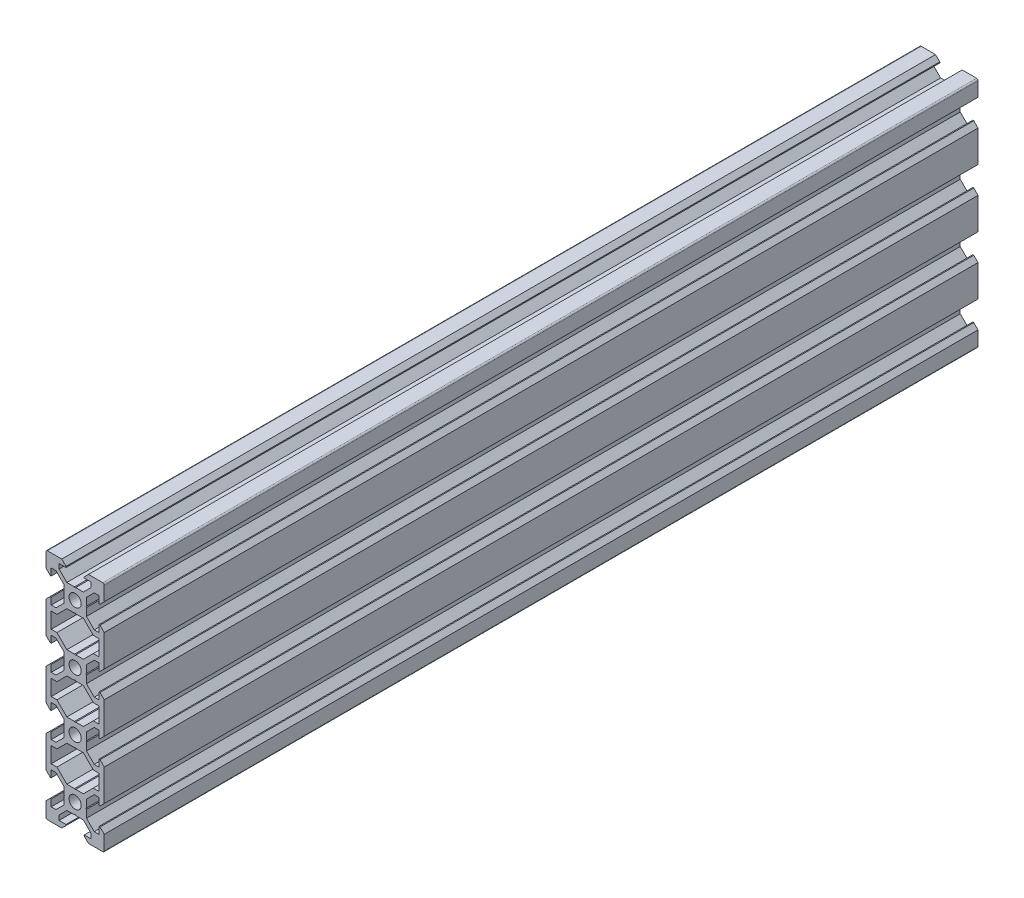
from build123d import *

# Parameters (mm, degrees)
BOSS_EXTRU_1_DEPTH = 300


with BuildPart() as part:
    # Esquisse1 → Boss.-Extru.1 (new body)
    with BuildSketch(Plane.XY):
        with BuildLine():
            Line((-9.5, 10), (-4.58, 10))
            Line((-4.58, 10), (-3.125, 8.545))
            Line((-3.125, 8.545), (-3.125, 8.2))
            Line((-3.125, 8.2), (-5.5, 8.2))
            Line((-5.5, 8.2), (-5.5, 6.560660172))
            Line((-5.5, 6.560660172), (-2.839339828, 3.9))
            Line((-2.839339828, 3.9), (-0.21, 3.9))
            Line((-0.21, 3.9), (0, 3.69))
            Line((0, 3.69), (0, 2.1))
            ThreePointArc((0, 2.1), (-2.1, 0), (0, -2.1))
            Line((0, -2.1), (0, -3.69))
            Line((0, -3.69), (-0.21, -3.9))
            Line((-0.21, -3.9), (-2.839339828, -3.9))
            Line((-2.839339828, -3.9), (-6.239339828, -7.3))
            Line((-6.239339828, -7.3), (-8.2, -7.3))
            Line((-8.2, -7.3), (-8.2, -12.7))
            Line((-8.2, -12.7), (-6.239339828, -12.7))
            Line((-6.239339828, -12.7), (-2.839339828, -16.1))
            Line((-2.839339828, -16.1), (-0.21, -16.1))
            Line((-0.21, -16.1), (0, -16.31))
            Line((0, -16.31), (0, -17.9))
            ThreePointArc((0, -17.9), (-2.1, -20), (0, -22.1))
            Line((0, -22.1), (0, -23.69))
            Line((0, -23.69), (-0.21, -23.9))
            Line((-0.21, -23.9), (-2.839339828, -23.9))
            Line((-2.839339828, -23.9), (-6.239339828, -27.3))
            Line((-6.239339828, -27.3), (-8.2, -27.3))
            Line((-8.2, -27.3), (-8.2, -32.7))
            Line((-8.2, -32.7), (-6.239339828, -32.7))
            Line((-6.239339828, -32.7), (-2.839339828, -36.1))
            Line((-2.839339828, -36.1), (-0.21, -36.1))
            Line((-0.21, -36.1), (0, -36.31))
            Line((0, -36.31), (0, -37.9))
            ThreePointArc((0, -37.9), (-2.1, -40), (0, -42.1))
            Line((0, -42.1), (0, -43.69))
            Line((0, -43.69), (-0.21, -43.9))
            Line((-0.21, -43.9), (-2.839339828, -43.9))
            Line((-2.839339828, -43.9), (-6.239339828, -47.3))
            Line((-6.239339828, -47.3), (-8.2, -47.3))
            Line((-8.2, -47.3), (-8.2, -52.7))
            Line((-8.2, -52.7), (-6.239339828, -52.7))
            Line((-6.239339828, -52.7), (-2.839339828, -56.1))
            Line((-2.839339828, -56.1), (-0.21, -56.1))
            Line((-0.21, -56.1), (0, -56.31))
            Line((0, -56.31), (0, -57.9))
            ThreePointArc((0, -57.9), (-2.1, -60), (0, -62.1))
            Line((0, -62.1), (0, -63.69))
            Line((0, -63.69), (-0.21, -63.9))
            Line((-0.21, -63.9), (-2.839339828, -63.9))
            Line((-2.839339828, -63.9), (-5.5, -66.560660172))
            Line((-5.5, -66.560660172), (-5.5, -68.2))
            Line((-5.5, -68.2), (-3.125, -68.2))
            Line((-3.125, -68.2), (-3.125, -68.545))
            Line((-3.125, -68.545), (-4.58, -70))
            Line((-4.58, -70), (-9.5, -70))
            ThreePointArc((-9.5, -70), (-9.853553391, -69.853553391), (-10, -69.5))
            Line((-10, -69.5), (-10, -64.58))
            Line((-10, -64.58), (-8.545, -63.125))
            Line((-8.545, -63.125), (-8.2, -63.125))
            Line((-8.2, -63.125), (-8.2, -65.5))
            Line((-8.2, -65.5), (-6.560660172, -65.5))
            Line((-6.560660172, -65.5), (-3.9, -62.839339828))
            Line((-3.9, -62.839339828), (-3.9, -60.21))
            Line((-3.9, -60.21), (-3.69, -60))
            Line((-3.69, -60), (-3.9, -59.79))
            Line((-3.9, -59.79), (-3.9, -57.160660172))
            Line((-3.9, -57.160660172), (-6.560660172, -54.5))
            Line((-6.560660172, -54.5), (-8.2, -54.5))
            Line((-8.2, -54.5), (-8.2, -56.875))
            Line((-8.2, -56.875), (-8.545, -56.875))
            Line((-8.545, -56.875), (-10, -55.42))
            Line((-10, -55.42), (-10, -44.58))
            Line((-10, -44.58), (-8.545, -43.125))
            Line((-8.545, -43.125), (-8.2, -43.125))
            Line((-8.2, -43.125), (-8.2, -45.5))
            Line((-8.2, -45.5), (-6.560660172, -45.5))
            Line((-6.560660172, -45.5), (-3.9, -42.839339828))
            Line((-3.9, -42.839339828), (-3.9, -40.21))
            Line((-3.9, -40.21), (-3.69, -40))
            Line((-3.69, -40), (-3.9, -39.79))
            Line((-3.9, -39.79), (-3.9, -37.160660172))
            Line((-3.9, -37.160660172), (-6.560660172, -34.5))
            Line((-6.560660172, -34.5), (-8.2, -34.5))
            Line((-8.2, -34.5), (-8.2, -36.875))
            Line((-8.2, -36.875), (-8.545, -36.875))
            Line((-8.545, -36.875), (-10, -35.42))
            Line((-10, -35.42), (-10, -24.58))
            Line((-10, -24.58), (-8.545, -23.125))
            Line((-8.545, -23.125), (-8.2, -23.125))
            Line((-8.2, -23.125), (-8.2, -25.5))
            Line((-8.2, -25.5), (-6.560660172, -25.5))
            Line((-6.560660172, -25.5), (-3.9, -22.839339828))
            Line((-3.9, -22.839339828), (-3.9, -20.21))
            Line((-3.9, -20.21), (-3.69, -20))
            Line((-3.69, -20), (-3.9, -19.79))
            Line((-3.9, -19.79), (-3.9, -17.160660172))
            Line((-3.9, -17.160660172), (-6.560660172, -14.5))
            Line((-6.560660172, -14.5), (-8.2, -14.5))
            Line((-8.2, -14.5), (-8.2, -16.875))
            Line((-8.2, -16.875), (-8.545, -16.875))
            Line((-8.545, -16.875), (-10, -15.42))
            Line((-10, -15.42), (-10, -4.58))
            Line((-10, -4.58), (-8.545, -3.125))
            Line((-8.545, -3.125), (-8.2, -3.125))
            Line((-8.2, -3.125), (-8.2, -5.5))
            Line((-8.2, -5.5), (-6.560660172, -5.5))
            Line((-6.560660172, -5.5), (-3.9, -2.839339828))
            Line((-3.9, -2.839339828), (-3.9, -0.21))
            Line((-3.9, -0.21), (-3.69, 0))
            Line((-3.69, 0), (-3.9, 0.21))
            Line((-3.9, 0.21), (-3.9, 2.839339828))
            Line((-3.9, 2.839339828), (-6.560660172, 5.5))
            Line((-6.560660172, 5.5), (-8.2, 5.5))
            Line((-8.2, 5.5), (-8.2, 3.125))
            Line((-8.2, 3.125), (-8.545, 3.125))
            Line((-8.545, 3.125), (-10, 4.58))
            Line((-10, 4.58), (-10, 9.5))
            ThreePointArc((-10, 9.5), (-9.853553391, 9.853553391), (-9.5, 10))
        make_face()
    boss_extru_1 = extrude(amount=BOSS_EXTRU_1_DEPTH)

    # Symétrie1: Boss.-Extru.1 across Right Plane
    add(boss_extru_1.mirror(Plane(origin=(0, 0, 0), x_dir=(0, 0, -1), z_dir=(1, 0, 0))))


solid = part.part
